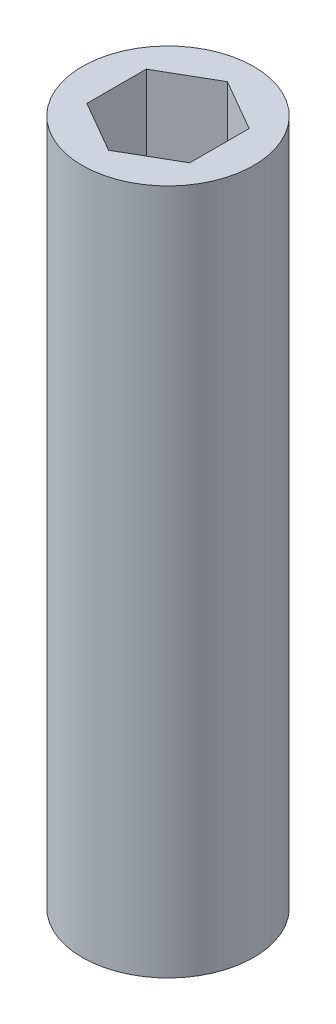
from build123d import *

# Parameters (mm, degrees)
SKETCH_1_R          = 10
SKETCH_1_R_2        = 4
EXTRUDE_1_DEPTH     = 80
CUT_EXTRUDE_1_DEPTH = 18


with BuildPart() as part:
    # 草图1 → 凸台-拉伸1 (new body)
    with BuildSketch(Plane(origin=(0, 0, 0), x_dir=(1, 0, 0), z_dir=(0, 1, 0))):
        with Locations(Location((0, 0, 0), (0, 0, 270))):
            Circle(SKETCH_1_R)
        with Locations(Location((0, 0, 0), (0, 0, 270))):
            Circle(SKETCH_1_R_2, mode=Mode.SUBTRACT)
    extrude(amount=EXTRUDE_1_DEPTH)

    # 草图2 → 切除-拉伸1 (cut)
    with BuildSketch(Plane(origin=(0, 80, 0), x_dir=(1, 0, 0), z_dir=(0, 1, 0))):
        Polygon((0, -6.92820323), (6, -3.464101615), (6, 3.464101615), (0, 6.92820323), (-6, 3.464101615), (-6, -3.464101615), align=None)
    extrude(amount=-CUT_EXTRUDE_1_DEPTH, mode=Mode.SUBTRACT)


solid = part.part
